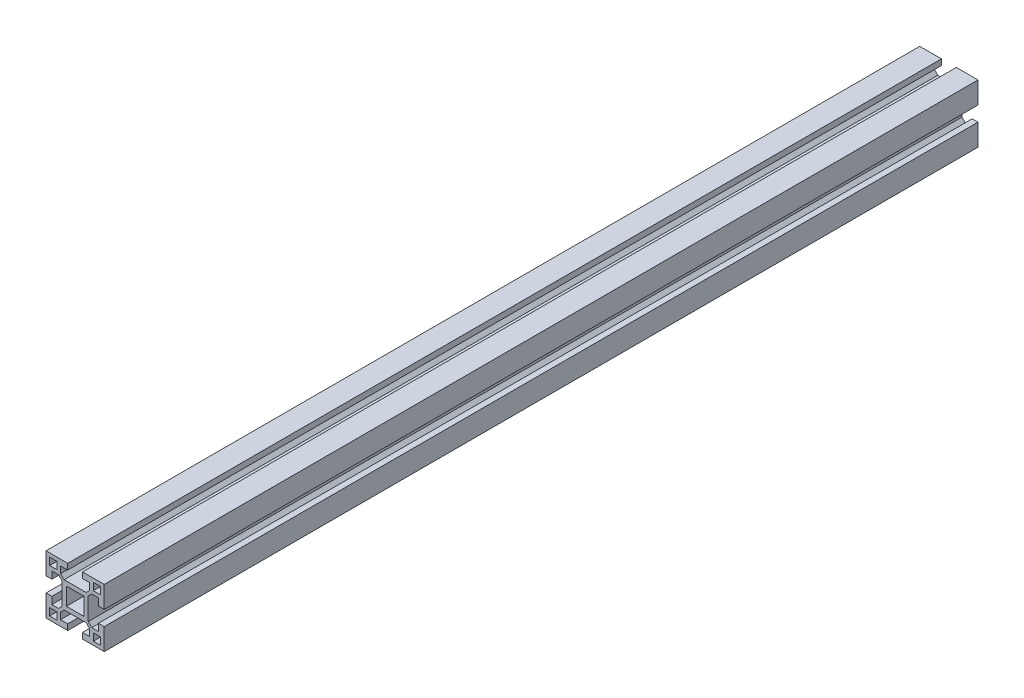
from build123d import *

# Parameters (mm, degrees)
ESQUISSE1_W        = 5
ESQUISSE1_H        = 5
BOSS_EXTRU_1_DEPTH = 600


with BuildPart() as part:
    # Esquisse1 → Boss.-Extru.1 (new body)
    with BuildSketch(Plane.XY):
        Polygon((0, 9), (7.585786438, 9), (10, 11.414213562), (10, 16), (5.1, 16), (5.1, 20), (20, 20), (20, 5.1), (16, 5.1), (16, 10), (11.414213562, 10), (9, 7.585786438), (9, 0), (9, -7.585786438), (11.414213562, -10), (16, -10), (16, -5.1), (20, -5.1), (20, -20), (5.1, -20), (5.1, -16), (10, -16), (10, -11.414213562), (7.585786438, -9), (0, -9), (-7.585786438, -9), (-10, -11.414213562), (-10, -16), (-5.1, -16), (-5.1, -20), (-20, -20), (-20, -5.1), (-16, -5.1), (-16, -10), (-11.414213562, -10), (-9, -7.585786438), (-9, 0), (-9, 7.585786438), (-11.414213562, 10), (-16, 10), (-16, 5.1), (-20, 5.1), (-20, 20), (-5.1, 20), (-5.1, 16), (-10, 16), (-10, 11.414213562), (-7.585786438, 9), align=None)
        with Locations((15, 15)):
            Rectangle(ESQUISSE1_W, ESQUISSE1_H, mode=Mode.SUBTRACT)
        Polygon((0, 6), (6, 6), (6, 0), (6, -6), (0, -6), (-6, -6), (-6, 0), (-6, 6), align=None, mode=Mode.SUBTRACT)
        with Locations((15, -15)):
            Rectangle(ESQUISSE1_W, ESQUISSE1_H, mode=Mode.SUBTRACT)
        with Locations((-15, -15)):
            Rectangle(ESQUISSE1_W, ESQUISSE1_H, mode=Mode.SUBTRACT)
        with Locations((-15, 15)):
            Rectangle(ESQUISSE1_W, ESQUISSE1_H, mode=Mode.SUBTRACT)
    extrude(amount=BOSS_EXTRU_1_DEPTH)


solid = part.part
